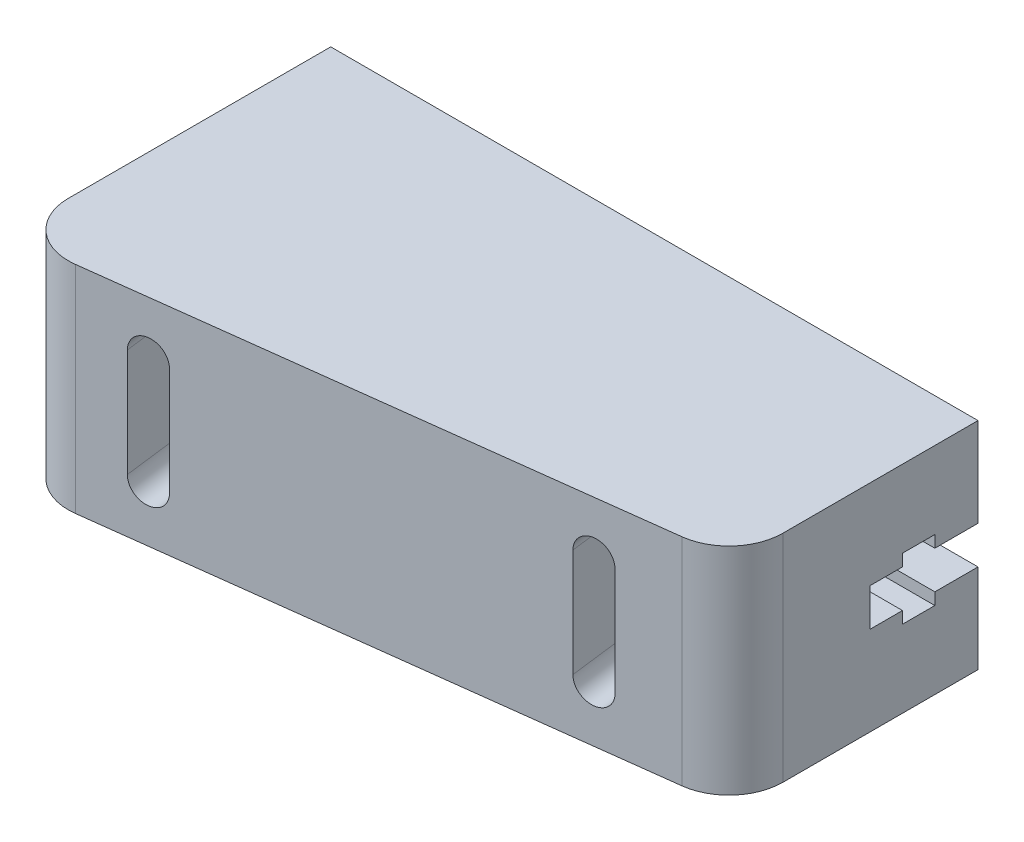
from build123d import *

# Parameters (mm, degrees)
SKETCH1_W           = 60
SKETCH1_H           = 20
BOSS_EXTRUDE1_DEPTH = 30
CUT_EXTRUDE1_DEPTH  = 47.904157598
CUT_EXTRUDE2_START  = -4
CUT_EXTRUDE2_DEPTH  = 43.904157598
CUT_EXTRUDE3_DEPTH  = 68.823299831
CUT_EXTRUDE4_DEPTH  = 5
FILLET1_R           = 5


with BuildPart() as part:
    # Sketch1 → Boss-Extrude1 (new body)
    with BuildSketch(Plane.XY):
        Rectangle(SKETCH1_W, SKETCH1_H)
    extrude(amount=BOSS_EXTRUDE1_DEPTH)

    # Sketch2 → Cut-Extrude1 (cut, through all)
    with BuildSketch(Plane(origin=(0, 10, 0), x_dir=(1, 0, 0), z_dir=(0, 1, 0))):
        Polygon((-30, -30), (30, -30), (30, -22.5), align=None)
    extrude(amount=-CUT_EXTRUDE1_DEPTH, mode=Mode.SUBTRACT)

    # Sketch3 → Cut-Extrude2 (cut, through all)
    with BuildSketch(Plane(origin=(0, 10, 0), x_dir=(1, 0, 0), z_dir=(0, 1, 0)).offset(CUT_EXTRUDE2_START)):
        Polygon((-25, 0), (25, 0), (25, -18.086088907), (-25, -24.336088907), align=None)
    extrude(amount=-CUT_EXTRUDE2_DEPTH, mode=Mode.SUBTRACT)

    # Sketch4 → Cut-Extrude3 (cut, through all)
    with BuildSketch(Plane.ZY.offset(30)):
        Polygon((0, 1.75), (4, 1.75), (4, 2.85), (7, 2.85), (7, 1.75), (10, 1.75), (10, -1.75), (7, -1.75), (7, -2.85), (4, -2.85), (4, -1.75), (0, -1.75), align=None)
    extrude(amount=-CUT_EXTRUDE3_DEPTH, mode=Mode.SUBTRACT)

    # Sketch5 → Cut-Extrude4 (cut)
    with BuildSketch(Plane(origin=(3.230769231, 0, 25.846153846), x_dir=(0.9922778767136677, 0, -0.1240347345892085), z_dir=(0.1240347345892085, 0, 0.9922778767136677))):
        with BuildLine():
            Line((-20.005911783, 5), (-20.005911783, -5))
            ThreePointArc((-20.005911783, -5), (-21.755911783, -6.75), (-23.505911783, -5))
            Line((-23.505911783, -5), (-23.505911783, 5))
            ThreePointArc((-23.505911783, 5), (-21.755911783, 6.75), (-20.005911783, 5))
        make_face()
        with BuildLine():
            Line((16.994088217, 5), (16.994088217, -5))
            ThreePointArc((16.994088217, -5), (15.244088217, -6.75), (13.494088217, -5))
            Line((13.494088217, -5), (13.494088217, 5))
            ThreePointArc((13.494088217, 5), (15.244088217, 6.75), (16.994088217, 5))
        make_face()
    extrude(amount=-CUT_EXTRUDE4_DEPTH, mode=Mode.SUBTRACT)

    # Fillet1
    fillet1_edges = [part.edges().sort_by_distance(p)[0] for p in [
        (-30, 0, 30),
        (30, 0, 22.5),
    ]]
    fillet(fillet1_edges, radius=FILLET1_R)


solid = part.part
